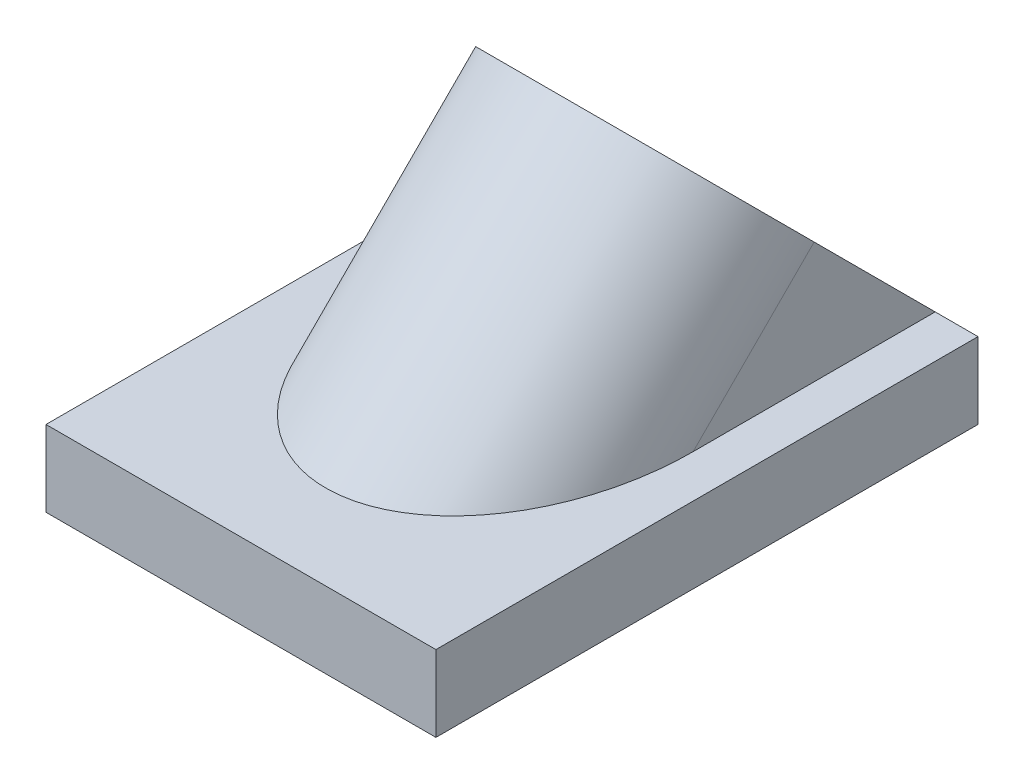
from build123d import *

# Parameters (mm, degrees)
SKETCH_1_W          = 57
SKETCH_1_H          = 8
EXTRUDE_1_DEPTH     = 41
EXTRUDE_2_REACH     = 65.274
SKETCH_3_R          = 8
CUT_EXTRUDE_1_DEPTH = 41


with BuildPart() as part:
    # 草图1 → 凸台-拉伸1 (new body)
    with BuildSketch(Plane(origin=(0, 0, 0), x_dir=(0, 0, -1), z_dir=(1, 0, 0))):
        with Locations((0, -4)):
            Rectangle(SKETCH_1_W, SKETCH_1_H)
    extrude(amount=-EXTRUDE_1_DEPTH)

    # 草图2 → 凸台-拉伸2 (add, up to next)
    with BuildSketch(Plane(origin=(0, 14.25, -14.25), x_dir=(1, 0, 0), z_dir=(0, 0.7071067811865488, -0.7071067811865464)), mode=Mode.PRIVATE) as extrude_2_sk1:
        with BuildLine():
            Line((-36.5, 2.152543264), (-36.5, 20.152543264))
            Line((-36.5, 20.152543264), (-4.5, 20.152543264))
            Line((-4.5, 20.152543264), (-4.5, 2.152543264))
            ThreePointArc((-4.5, 2.152543264), (-20.5, -13.847456736), (-36.5, 2.152543264))
        make_face()
    extrude_2_tool1 = extrude(extrude_2_sk1.sketch, amount=-EXTRUDE_2_REACH, mode=Mode.PRIVATE) - part.part
    add(extrude_2_tool1.solids().sort_by_distance((-20.5, 10.954355, -17.545645))[0])

    # 草图3 → 切除-拉伸1 (cut)
    with BuildSketch(Plane(origin=(0, 14.25, -14.25), x_dir=(1, 0, 0), z_dir=(0, 0.7071067811865488, -0.7071067811865464))):
        with Locations(Location((-20.5, 2.152543264, 0), (0, 0, 270))):
            Circle(SKETCH_3_R)
    extrude(amount=-CUT_EXTRUDE_1_DEPTH, mode=Mode.SUBTRACT)


solid = part.part
